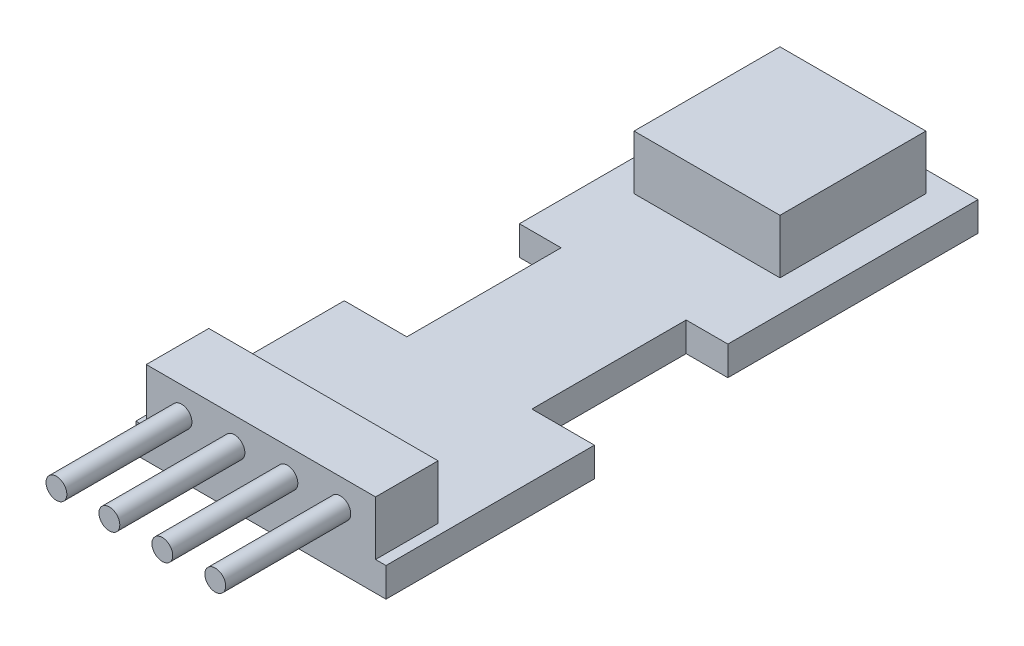
from build123d import *

# Parameters (mm, degrees)
BOSS_EXTRUDE1_DEPTH = 0.7
SKETCH2_W           = 3.5
SKETCH2_H           = 3.5
SKETCH2_W_2         = 5.5
SKETCH2_H_2         = 1.5
BOSS_EXTRUDE2_DEPTH = 1.3
SKETCH3_R           = 0.25
BOSS_EXTRUDE3_DEPTH = 3


with BuildPart() as part:
    # Sketch1 → Boss-Extrude1 (new body)
    with BuildSketch(Plane(origin=(0, 0, 0), x_dir=(1, 0, 0), z_dir=(0, 1, 0))):
        Polygon((0, 0), (0, 5), (1.5, 5), (1.5, 8.7), (0.5, 8.7), (0.5, 14.7), (5.5, 14.7), (5.5, 8.7), (4.5, 8.7), (4.5, 5), (6, 5), (6, 0), align=None)
    extrude(amount=BOSS_EXTRUDE1_DEPTH)

    # Sketch2 → Boss-Extrude2 (add)
    with BuildSketch(Plane(origin=(0, 0.7, 0), x_dir=(1, 0, 0), z_dir=(0, 1, 0))):
        with Locations((3, 12.45)):
            Rectangle(SKETCH2_W, SKETCH2_H)
        with Locations((3, 0.75)):
            Rectangle(SKETCH2_W_2, SKETCH2_H_2)
    extrude(amount=BOSS_EXTRUDE2_DEPTH)

    # Sketch3 → Boss-Extrude3 (add)
    with BuildSketch(Plane.XY):
        with Locations(Location((1.095, 1.35, 0), (0, 0, 180))):
            Circle(SKETCH3_R)
        with Locations(Location((2.365, 1.35, 0), (0, 0, 180))):
            Circle(SKETCH3_R)
        with Locations(Location((3.635, 1.35, 0), (0, 0, 180))):
            Circle(SKETCH3_R)
        with Locations(Location((4.905, 1.35, 0), (0, 0, 180))):
            Circle(SKETCH3_R)
    extrude(amount=BOSS_EXTRUDE3_DEPTH)


solid = part.part
